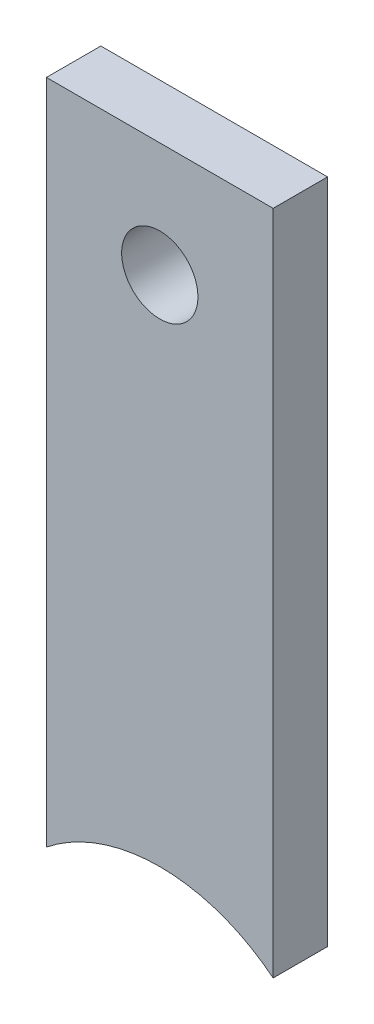
from build123d import *

# Parameters (mm, degrees)
SKETCH1_R           = 8.412952976
BOSS_EXTRUDE1_DEPTH = 12


with BuildPart() as part:
    # Sketch1 → Boss-Extrude1 (new body)
    with BuildSketch(Plane.XY):
        with BuildLine():
            Line((-25, -73.5), (-25, 73.5))
            Line((-25, 73.5), (25, 73.5))
            Line((25, 73.5), (25, -73.5))
            ThreePointArc((25, -73.5), (0, -64.724989992), (-25, -73.5))
        make_face()
        with Locations((0, 48.275010008)):
            Circle(SKETCH1_R, mode=Mode.SUBTRACT)
    extrude(amount=BOSS_EXTRUDE1_DEPTH)


solid = part.part
